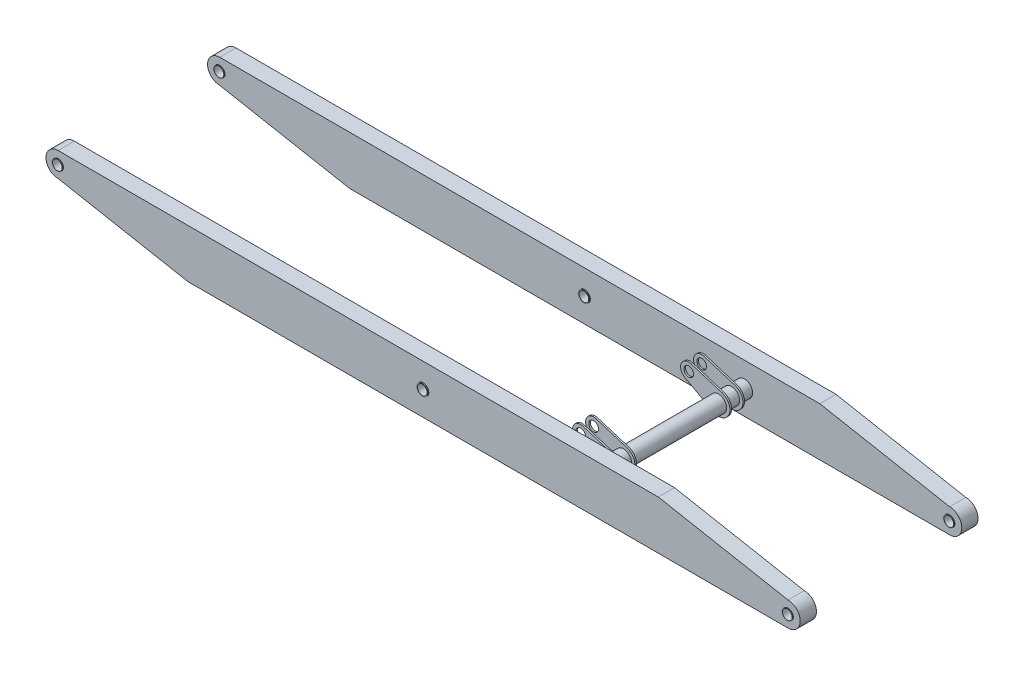
from build123d import *

# Parameters (mm, degrees)
EXTRUDE_1_DEPTH        = 100
SKETCH_2_R             = 30
CUT_EXTRUDE_1_DEPTH    = 100
SKETCH_3_R             = 32.5
SKETCH_3_R_2           = 30
EXTRUDE_2_DEPTH        = 5
EXTRUDE_START          = 5
SKETCH_4_R             = 32.5
SKETCH_4_R_2           = 30
EXTRUDE_3_DEPTH        = 5
SKETCH_5_R             = 30
CUT_EXTRUDE_3_DEPTH    = 552
SKETCH_6_R             = 35
SKETCH_6_R_2           = 30
EXTRUDE_4_DEPTH        = 5
SKETCH_7_R             = 35
SKETCH_7_R_2           = 30
EXTRUDE_5_DEPTH        = 5
SKETCH_8_R             = 50
EXTRUDE_6_DEPTH        = 448
EXTRUDE_7_DEPTH        = 10
SKETCH_10_R            = 30
CUT_EXTRUDE_4_DEPTH    = 10
PATTERN_LINEAR_1_COUNT = 2
PATTERN_LINEAR_1_PITCH = 80
MIRROR_2_COPY_1_DEPTH  = 10
SKETCH_11_R            = 30
CUT_EXTRUDE_5_DEPTH    = 800
SCALE1_SCALE           = 0.345


with BuildPart() as part:
    # 草图1 → 凸台-拉伸1 (new body)
    with BuildSketch(Plane.XY):
        with BuildLine():
            Line((-60.1323511, -127.533248731), (739.8676489, -277.533248731))
            Line((739.8676489, -277.533248731), (4439.8676489, -277.533248731))
            ThreePointArc((4439.8676489, -277.533248731), (4514.8676489, -202.533248731), (4439.8676489, -127.533248731))
            Line((4439.8676489, -127.533248731), (3639.8676489, 22.466751269))
            Line((3639.8676489, 22.466751269), (-60.1323511, 22.466751269))
            ThreePointArc((-60.1323511, 22.466751269), (-135.1323511, -52.533248731), (-60.1323511, -127.533248731))
        make_face()
    extrude(amount=EXTRUDE_1_DEPTH)

    # 草图2 → 切除-拉伸1 (cut)
    with BuildSketch(Plane.XY.offset(100)):
        with Locations((-60.1323511, -52.533248731)):
            Circle(SKETCH_2_R)
        with Locations((4439.8676489, -202.533248731)):
            Circle(SKETCH_2_R)
    extrude(amount=-CUT_EXTRUDE_1_DEPTH, mode=Mode.SUBTRACT)

    # 草图3 → 凸台-拉伸2 (add)
    # profile 1 of 2: a face of its own
    with BuildSketch(Plane(origin=(0, 0, 0), x_dir=(-1, 0, 0), z_dir=(0, 0, -1))):
        with Locations(Location((-4439.8676489, -202.533248731, 0), (0, 0, 180))):
            Circle(SKETCH_3_R)
        with Locations(Location((-4439.8676489, -202.533248731, 0), (0, 0, 180))):
            Circle(SKETCH_3_R_2, mode=Mode.SUBTRACT)
    # profile 2 of 2: a face of its own
    with BuildSketch(Plane(origin=(0, 0, 0), x_dir=(-1, 0, 0), z_dir=(0, 0, -1))):
        with Locations(Location((60.1323511, -52.533248731, 0), (0, 0, 180))):
            Circle(SKETCH_3_R)
        with Locations(Location((60.1323511, -52.533248731, 0), (0, 0, 180))):
            Circle(SKETCH_3_R_2, mode=Mode.SUBTRACT)
    extrude(amount=EXTRUDE_2_DEPTH)

    # 草图4 → 凸台-拉伸3 (add)
    # profile 1 of 2: a face of its own
    with BuildSketch(Plane.XY.offset(100).offset(EXTRUDE_START)):
        with Locations((-60.1323511, -52.533248731)):
            Circle(SKETCH_4_R)
        with Locations((-60.1323511, -52.533248731)):
            Circle(SKETCH_4_R_2, mode=Mode.SUBTRACT)
    # profile 2 of 2: a face of its own
    with BuildSketch(Plane.XY.offset(100).offset(EXTRUDE_START)):
        with Locations((4439.8676489, -202.533248731)):
            Circle(SKETCH_4_R)
        with Locations((4439.8676489, -202.533248731)):
            Circle(SKETCH_4_R_2, mode=Mode.SUBTRACT)
    extrude(amount=-EXTRUDE_3_DEPTH)

    # 草图5 → 切除-拉伸3 (cut)
    with BuildSketch(Plane(origin=(0, 0, 0), x_dir=(-1, 0, 0), z_dir=(0, 0, -1))):
        with Locations((-2189.8676489, -127.533248731)):
            Circle(SKETCH_5_R)
    extrude(amount=-CUT_EXTRUDE_3_DEPTH, mode=Mode.SUBTRACT)

    # 草图6 → 凸台-拉伸4 (add)
    with BuildSketch(Plane.XY.offset(100)):
        with Locations((2189.8676489, -127.533248731)):
            Circle(SKETCH_6_R)
        with Locations(Location((2189.8676489, -127.533248731, 0), (0, 0, 180))):
            Circle(SKETCH_6_R_2, mode=Mode.SUBTRACT)
    extrude(amount=EXTRUDE_4_DEPTH)

    # 草图7 → 凸台-拉伸5 (add)
    with BuildSketch(Plane(origin=(0, 0, 0), x_dir=(-1, 0, 0), z_dir=(0, 0, -1)).offset(EXTRUDE_START)):
        with Locations(Location((-2189.8676489, -127.533248731, 0), (0, 0, 180))):
            Circle(SKETCH_7_R)
        with Locations((-2189.8676489, -127.533248731)):
            Circle(SKETCH_7_R_2, mode=Mode.SUBTRACT)
    extrude(amount=-EXTRUDE_5_DEPTH)

    # 草图8 → 凸台-拉伸6 (add)
    with BuildSketch(Plane(origin=(0, 0, 0), x_dir=(-1, 0, 0), z_dir=(0, 0, -1))):
        with Locations(Location((-3175.422502192, -127.533248731, 0), (0, 0, 180))):
            Circle(SKETCH_8_R)
    extrude(amount=EXTRUDE_6_DEPTH)

    # 镜向1: part across plane


with BuildPart() as part_1:
    add(part.part)
    add(part.part.mirror(Plane(origin=(3175.422502192, -127.533248731, -448), x_dir=(1, 0, 0), z_dir=(0, 0, -1))))

    # 草图9 → 凸台-拉伸7 (add)
    with BuildSketch(Plane(origin=(0, 0, -736), x_dir=(-1, 0, 0), z_dir=(0, 0, -1))):
        with BuildLine():
            Line((-3006.157635441, -1.638829142), (-3196.193047707, -60.685777283))
            ThreePointArc((-3196.193047707, -60.685777283), (-3239.857841934, -154.884427725), (-3141.764888729, -188.91048438))
            Line((-3141.764888729, -188.91048438), (-2967.280379028, -93.22790564))
            ThreePointArc((-2967.280379028, -93.22790564), (-2945.296288829, -29.850466609), (-3006.157635441, -1.638829142))
        make_face()
    extrude_7 = extrude(amount=EXTRUDE_7_DEPTH)

    # 草图10 → 切除-拉伸4 (cut)
    with BuildSketch(Plane(origin=(0, 0, -746), x_dir=(-1, 0, 0), z_dir=(0, 0, -1))):
        with Locations((-2991.321531502, -49.387023033)):
            Circle(SKETCH_10_R)
    extrude(amount=-CUT_EXTRUDE_4_DEPTH, mode=Mode.SUBTRACT)

    # 阵列(线性)1: 凸台-拉伸7 ×2
    with Locations(*[(0, 0, -i * PATTERN_LINEAR_1_PITCH) for i in range(1, PATTERN_LINEAR_1_COUNT)]):
        add(extrude_7)

    # 镜向2: 凸台-拉伸7 across plane
    add(extrude_7.mirror(Plane(origin=(0, 0, -448), x_dir=(1, 0, 0), z_dir=(0, 0, -1))))

    # 镜向2 copy 1 sketch → 镜向2 copy 1 (add)
    with BuildSketch(Plane(origin=(0, 0, -80), x_dir=(-1, 0, 0), z_dir=(0, 0, 1))):
        with BuildLine():
            Line((-3006.157635441, 1.638829142), (-3196.193047707, 60.685777283))
            ThreePointArc((-3196.193047707, 60.685777283), (-3239.857841934, 154.884427725), (-3141.764888729, 188.91048438))
            Line((-3141.764888729, 188.91048438), (-2967.280379028, 93.22790564))
            ThreePointArc((-2967.280379028, 93.22790564), (-2945.296288829, 29.850466609), (-3006.157635441, 1.638829142))
        make_face()
    extrude(amount=MIRROR_2_COPY_1_DEPTH)

    # 草图11 → 切除-拉伸5 (cut)
    with BuildSketch(Plane(origin=(0, 0, -826), x_dir=(-1, 0, 0), z_dir=(0, 0, -1))):
        with Locations((-2991.321531502, -49.387023033)):
            Circle(SKETCH_11_R)
    extrude(amount=-CUT_EXTRUDE_5_DEPTH, mode=Mode.SUBTRACT)


with BuildPart() as part_2:
    # Scale1: scaled about (2220.490419966, -127.389558081, -448)
    add(part_1.part.scale(SCALE1_SCALE).moved(Location((1454.421225078, -83.440160543, -293.44))))


solid = part_2.part
